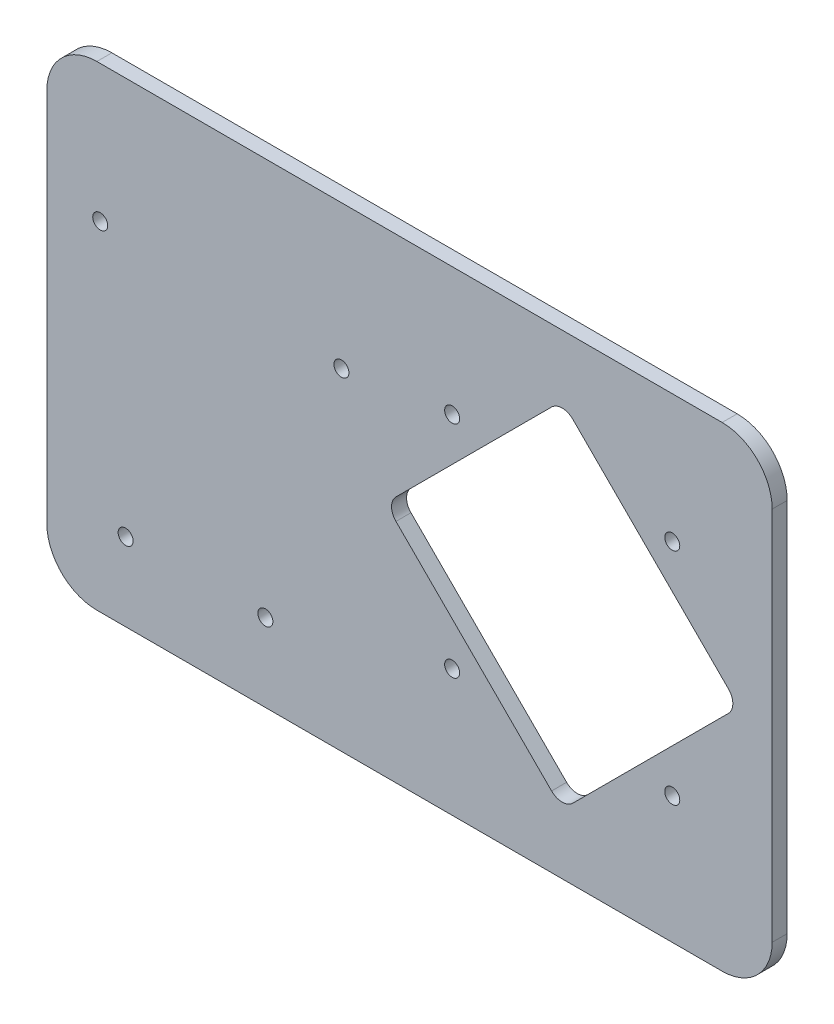
from build123d import *

# Parameters (mm, degrees)
ESQUISSE15_R        = 1.5
BOSS_EXTRU_15_DEPTH = 3


with BuildPart() as part:
    # Esquisse15 → Boss.-Extru.15 (new body)
    with BuildSketch(Plane.XY):
        with BuildLine():
            Line((210.81212736, -15.397544228), (85.81212736, -15.397544228))
            ThreePointArc((85.81212736, -15.397544228), (78.741059548, -18.326476416), (75.81212736, -25.397544228))
            Line((75.81212736, -25.397544228), (75.81212736, -100.397544228))
            ThreePointArc((75.81212736, -100.397544228), (78.741059548, -107.468612039), (85.81212736, -110.397544228))
            Line((85.81212736, -110.397544228), (210.81212736, -110.397544228))
            ThreePointArc((210.81212736, -110.397544228), (217.883195172, -107.468612039), (220.81212736, -100.397544228))
            Line((220.81212736, -100.397544228), (220.81212736, -25.397544228))
            ThreePointArc((220.81212736, -25.397544228), (217.883195172, -18.326476416), (210.81212736, -15.397544228))
        make_face()
        with Locations((156.837999603, -85.008074041)):
            Circle(ESQUISSE15_R, mode=Mode.SUBTRACT)
        with Locations((156.837999603, -41.004819048)):
            Circle(ESQUISSE15_R, mode=Mode.SUBTRACT)
        with Locations((200.841254596, -41.004819048)):
            Circle(ESQUISSE15_R, mode=Mode.SUBTRACT)
        with Locations((200.841254596, -85.008074041)):
            Circle(ESQUISSE15_R, mode=Mode.SUBTRACT)
        with Locations((86.484439521, -42.744244907)):
            Circle(ESQUISSE15_R, mode=Mode.SUBTRACT)
        with Locations((134.704025572, -44.113620634)):
            Circle(ESQUISSE15_R, mode=Mode.SUBTRACT)
        with Locations((119.499920391, -94.814244907)):
            Circle(ESQUISSE15_R, mode=Mode.SUBTRACT)
        with Locations((91.564439521, -94.814244907)):
            Circle(ESQUISSE15_R, mode=Mode.SUBTRACT)
        with BuildLine():
            Line((180.960947443, -29.772427829), (212.073645815, -60.885126201))
            ThreePointArc((212.073645815, -60.885126201), (212.952325471, -63.006446545), (212.073645815, -65.127766888))
            Line((212.073645815, -65.127766888), (180.960947443, -96.24046526))
            ThreePointArc((180.960947443, -96.24046526), (178.839627099, -97.119144917), (176.718306756, -96.24046526))
            Line((176.718306756, -96.24046526), (145.605608383, -65.127766888))
            ThreePointArc((145.605608383, -65.127766888), (144.726928727, -63.006446545), (145.605608383, -60.885126201))
            Line((145.605608383, -60.885126201), (176.718306756, -29.772427829))
            ThreePointArc((176.718306756, -29.772427829), (178.839627099, -28.893748172), (180.960947443, -29.772427829))
        make_face(mode=Mode.SUBTRACT)
    extrude(amount=BOSS_EXTRU_15_DEPTH)


solid = part.part
